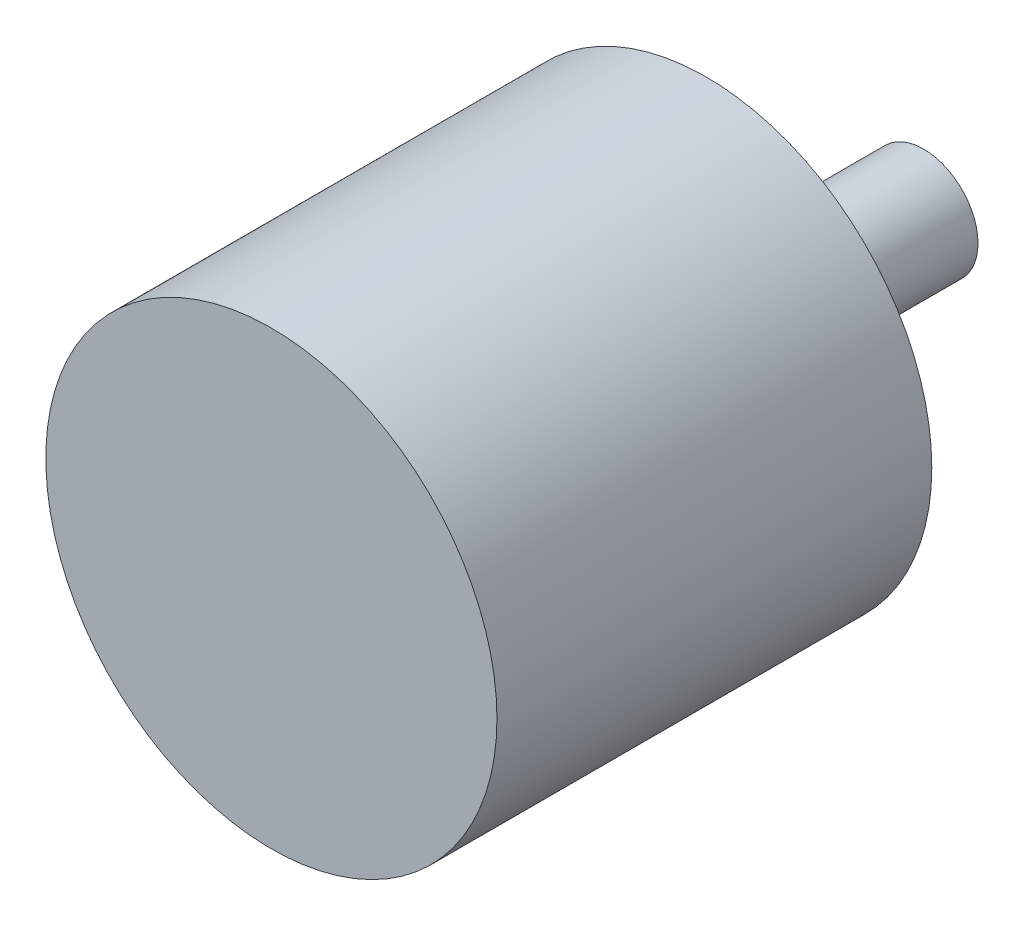
from build123d import *

# Parameters (mm, degrees)
SKETCH1_R           = 0.5
BOSS_EXTRUDE1_DEPTH = 2
SKETCH2_R           = 2.075
BOSS_EXTRUDE2_DEPTH = 4


with BuildPart() as part:
    # Sketch1 → Boss-Extrude1 (new body)
    with BuildSketch(Plane.XY):
        Circle(SKETCH1_R)
    extrude(amount=BOSS_EXTRUDE1_DEPTH)

    # Sketch2 → Boss-Extrude2 (add)
    with BuildSketch(Plane.XY.offset(2)):
        Circle(SKETCH2_R)
    extrude(amount=BOSS_EXTRUDE2_DEPTH)


solid = part.part
